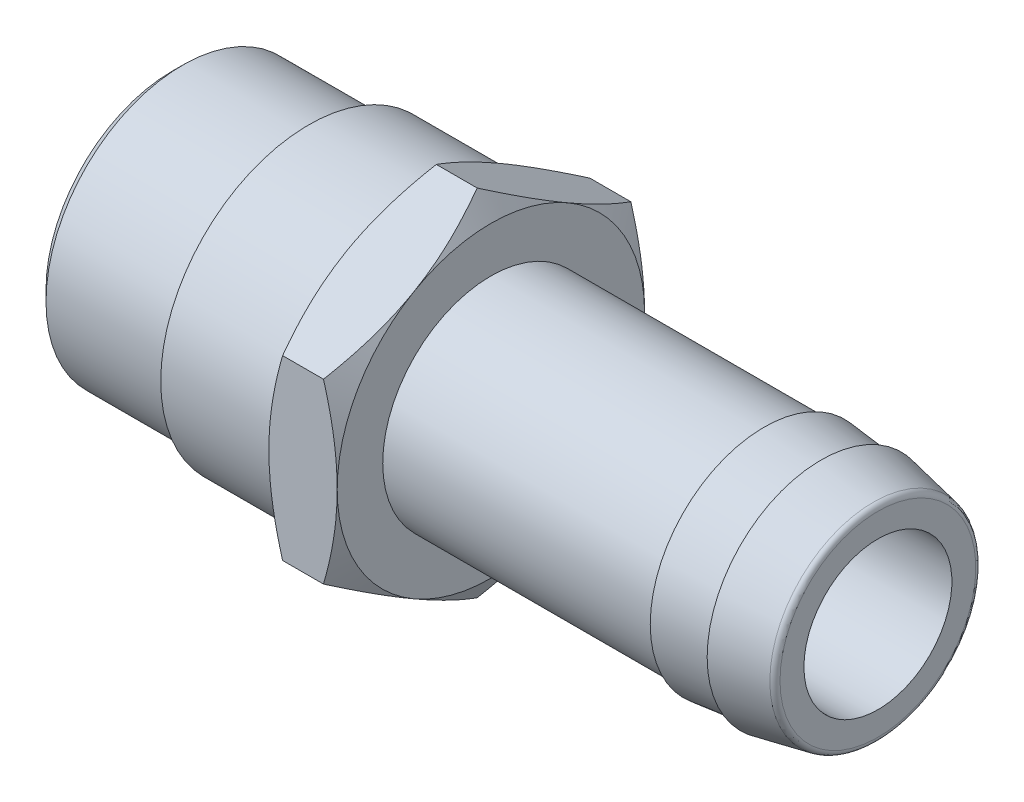
from build123d import *

# Parameters (mm, degrees)
SZKIC2_W                    = 10
SZKIC2_H                    = 13
DODANIE_WYCI_GNI_CIE1_DEPTH = 6
SZKIC4_W                    = 24
SZKIC4_H                    = 9.5


with BuildPart() as part:
    # Szkic1 → Obrót1 (revolve)
    with BuildSketch(Plane.XY, mode=Mode.PRIVATE) as obr_t1_sk:
        Polygon((0, 0), (0, 11.08), (0.92, 12), (12, 12), (12, 0), align=None)
    revolve(obr_t1_sk.sketch.rotate(Axis((12, 0, 0), (-1, 0, 0)), 270), axis=Axis((12, 0, 0), (-1, 0, 0)))

    # Szkic2 → Obrót2 (revolve)
    with BuildSketch(Plane.XY, mode=Mode.PRIVATE) as obr_t2_sk:
        with Locations((17, 6.5)):
            Rectangle(SZKIC2_W, SZKIC2_H)
    revolve(obr_t2_sk.sketch.rotate(Axis((22, 0, 0), (-1, 0, 0)), 270), axis=Axis((22, 0, 0), (-1, 0, 0)))

    # Szkic3 → Dodanie-wyciągnięcie1 (add)
    with BuildSketch(Plane(origin=(22, 0, 0), x_dir=(0, 0, -1), z_dir=(1, 0, 0))):
        Polygon((-13.5, 7.794228634), (-13.5, -7.794228634), (0, -15.588457268), (13.5, -7.794228634), (13.5, 7.794228634), (0, 15.588457268), align=None)
    extrude(amount=DODANIE_WYCI_GNI_CIE1_DEPTH)

    # Szkic4 → Obrót3 (revolve)
    with BuildSketch(Plane.XY, mode=Mode.PRIVATE) as obr_t3_sk:
        with Locations((40, 4.75)):
            Rectangle(SZKIC4_W, SZKIC4_H)
    revolve(obr_t3_sk.sketch.rotate(Axis((52, 0, 0), (-1, 0, 0)), 270), axis=Axis((52, 0, 0), (-1, 0, 0)))

    # Szkic5 → Obrót4 (revolve)
    with BuildSketch(Plane.XY, mode=Mode.PRIVATE) as obr_t4_sk:
        with BuildLine():
            Line((52, 0), (52, 10))
            Line((52, 10), (57, 9.5))
            Line((57, 9.5), (57, 10))
            Line((57, 10), (61.597042092, 9.090492439))
            ThreePointArc((61.597042092, 9.090492439), (61.886342494, 8.917394828), (62, 8.6))
            Line((62, 8.6), (62, 0))
            Line((62, 0), (52, 0))
        make_face()
    revolve(obr_t4_sk.sketch.rotate(Axis((62, 0, 0), (-1, 0, 0)), 270), axis=Axis((62, 0, 0), (-1, 0, 0)))

    # Szkic6 → Wycięcie-obrót1 (revolve, cut)
    with BuildSketch(Plane.XY, mode=Mode.PRIVATE) as wyci_cie_obr_t1_sk:
        Polygon((0, 0), (0, 7.207106781), (0.707106781, 6.5), (62, 6.5), (62, 0), align=None)
    revolve(wyci_cie_obr_t1_sk.sketch.rotate(Axis((62, 0, 0), (-1, 0, 0)), 270), axis=Axis((62, 0, 0), (-1, 0, 0)), mode=Mode.SUBTRACT)

    # Szkic7 → Wycięcie-obrót2 (revolve, cut)
    with BuildSketch(Plane.XY):
        Polygon((22, 13.5), (29.794228634, 27), (22, 27), align=None)
    revolve(axis=Axis((22, 0, 0), (-1, 0, 0)), mode=Mode.SUBTRACT)

    # Szkic8 → Wycięcie-obrót3 (revolve, cut)
    with BuildSketch(Plane.XY):
        Polygon((20.205771366, 27), (28, 13.5), (28, 27), align=None)
    revolve(axis=Axis((22, 0, 0), (-1, 0, 0)), mode=Mode.SUBTRACT)


solid = part.part
